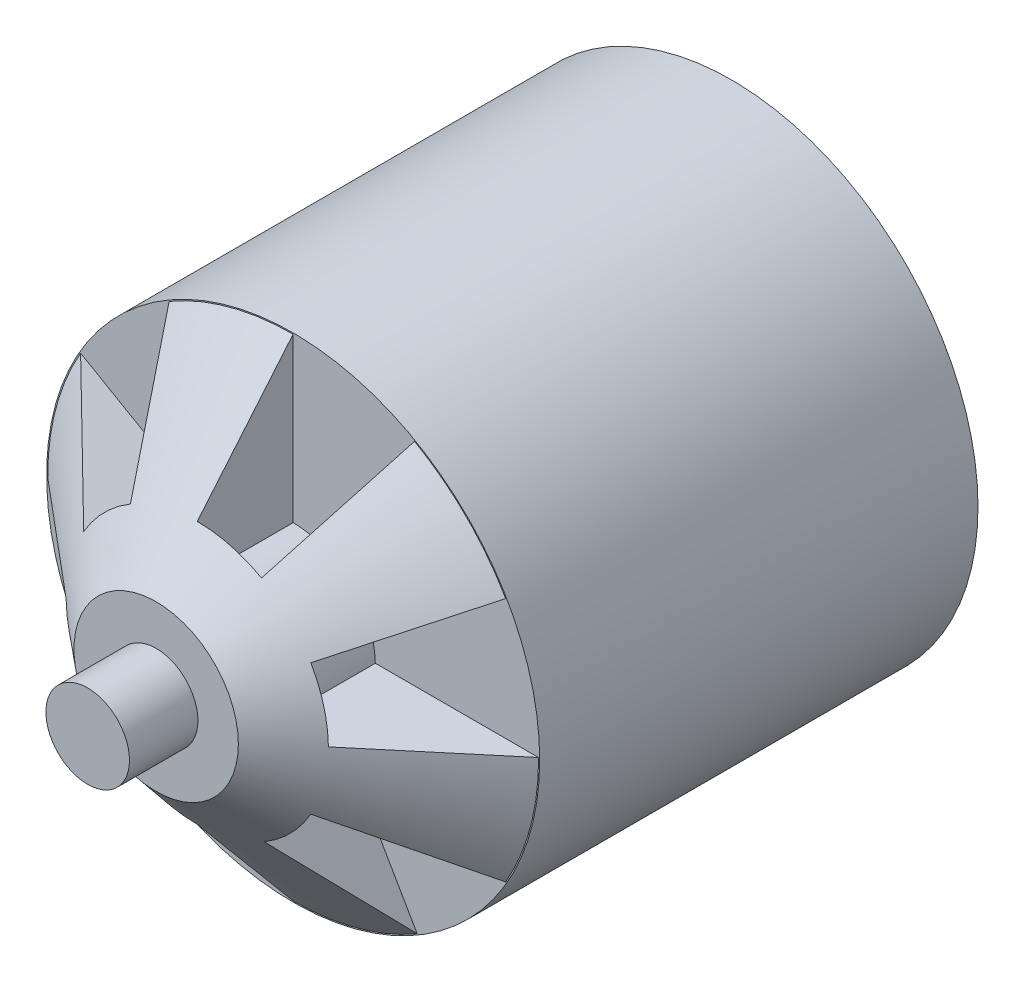
from build123d import *

# Parameters (mm, degrees)
SKETCH_1_R          = 18
EXTRUDE_1_DEPTH     = 32
SKETCH_2_R          = 1.5
CUT_EXTRUDE_1_DEPTH = 3
SKETCH_5_R          = 6
EXTRUDE_5_DEPTH     = 10
EXTRUDE_5_DRAFT     = 50
CUT_EXTRUDE_2_DEPTH = 7
SKETCH_8_R          = 3.05
EXTRUDE_6_DEPTH     = 5


with BuildPart() as part:
    # 草图1 → 凸台-拉伸1 (new body)
    with BuildSketch(Plane.XY):
        Circle(SKETCH_1_R)
    extrude(amount=EXTRUDE_1_DEPTH)

    # 草图2 → 切除-拉伸1 (cut)
    with BuildSketch(Plane(origin=(0, 0, 0), x_dir=(-1, 0, 0), z_dir=(0, 0, -1))):
        with Locations((-8.5, 0)):
            Circle(SKETCH_2_R)
        with Locations(Location((8.5, 0, 0), (0, 0, 180))):
            Circle(SKETCH_2_R)
        with Locations((0, 12.5)):
            Circle(SKETCH_2_R)
        with Locations(Location((0, -12.5, 0), (0, 0, 180))):
            Circle(SKETCH_2_R)
    extrude(amount=-CUT_EXTRUDE_1_DEPTH, mode=Mode.SUBTRACT)


with BuildPart() as body_2:
    # 草图5 → 凸台-拉伸5 (with draft: the straight prism first)
    with BuildSketch(Plane.XY.offset(42)):
        Circle(SKETCH_5_R)
    extrude(amount=-EXTRUDE_5_DEPTH)
    # 凸台-拉伸5: the draft: its side faces are tilted about the plane it starts from
    extrude_5_sides = [body_2.faces().sort_by_distance(p)[0] for p in [
        (-6, 0, 37),
    ]]
    draft(extrude_5_sides, Plane.XY.offset(42), EXTRUDE_5_DRAFT)

    # 草图7 → 切除-拉伸2 (cut)
    with BuildSketch(Plane(origin=(0, 0, 32), x_dir=(-1, 0, 0), z_dir=(0, 0, -1))):
        with BuildLine():
            Line((0, -6), (0, -17.917535926))
            ThreePointArc((0, -17.917535926), (4.584530168, -17.32109052), (8.863837345, -15.571463682))
            Line((8.863837345, -15.571463682), (2.90473751, -5.25))
            ThreePointArc((2.90473751, -5.25), (1.5, -5.809475019), (0, -6))
        make_face()
        with BuildLine():
            Line((-3.094264615, -5.140576475), (-9.05336445, -15.462040156))
            ThreePointArc((-9.05336445, -15.462040156), (-12.708239327, -12.63086485), (-15.517041285, -8.958767963))
            Line((-15.517041285, -8.958767963), (-5.196152423, -3))
            ThreePointArc((-5.196152423, -3), (-4.281152949, -4.203775615), (-3.094264615, -5.140576475))
        make_face()
        with BuildLine():
            Line((-5.999002125, 0.109423525), (-17.917201795, 0.109423525))
            ThreePointArc((-17.917201795, 0.109423525), (-17.292769495, 4.69022567), (-15.517041285, 8.958767963))
            Line((-15.517041285, 8.958767963), (-5.196152423, 3))
            ThreePointArc((-5.196152423, 3), (-5.781152949, 1.605699404), (-5.999002125, 0.109423525))
        make_face()
        with BuildLine():
            Line((-2.90473751, 5.25), (-8.863837345, 15.571463682))
            ThreePointArc((-8.863837345, 15.571463682), (-4.584530168, 17.32109052), (0, 17.917535926))
            Line((0, 17.917535926), (0, 6))
            ThreePointArc((0, 6), (-1.5, 5.809475019), (-2.90473751, 5.25))
        make_face()
        with BuildLine():
            Line((3.094264615, 5.140576475), (9.05336445, 15.462040156))
            ThreePointArc((9.05336445, 15.462040156), (12.708239327, 12.63086485), (15.517041285, 8.958767963))
            Line((15.517041285, 8.958767963), (5.196152423, 3))
            ThreePointArc((5.196152423, 3), (4.281152949, 4.203775615), (3.094264615, 5.140576475))
        make_face()
        with BuildLine():
            Line((5.999002125, -0.109423525), (17.917201795, -0.109423525))
            ThreePointArc((17.917201795, -0.109423525), (17.292769495, -4.69022567), (15.517041285, -8.958767963))
            Line((15.517041285, -8.958767963), (5.196152423, -3))
            ThreePointArc((5.196152423, -3), (5.781152949, -1.605699404), (5.999002125, -0.109423525))
        make_face()
    extrude(amount=-CUT_EXTRUDE_2_DEPTH, mode=Mode.SUBTRACT)

    # 草图8 → 凸台-拉伸6 (add)
    with BuildSketch(Plane.XY.offset(42)):
        Circle(SKETCH_8_R)
    extrude(amount=EXTRUDE_6_DEPTH)


solid = Compound([part.part, body_2.part])
